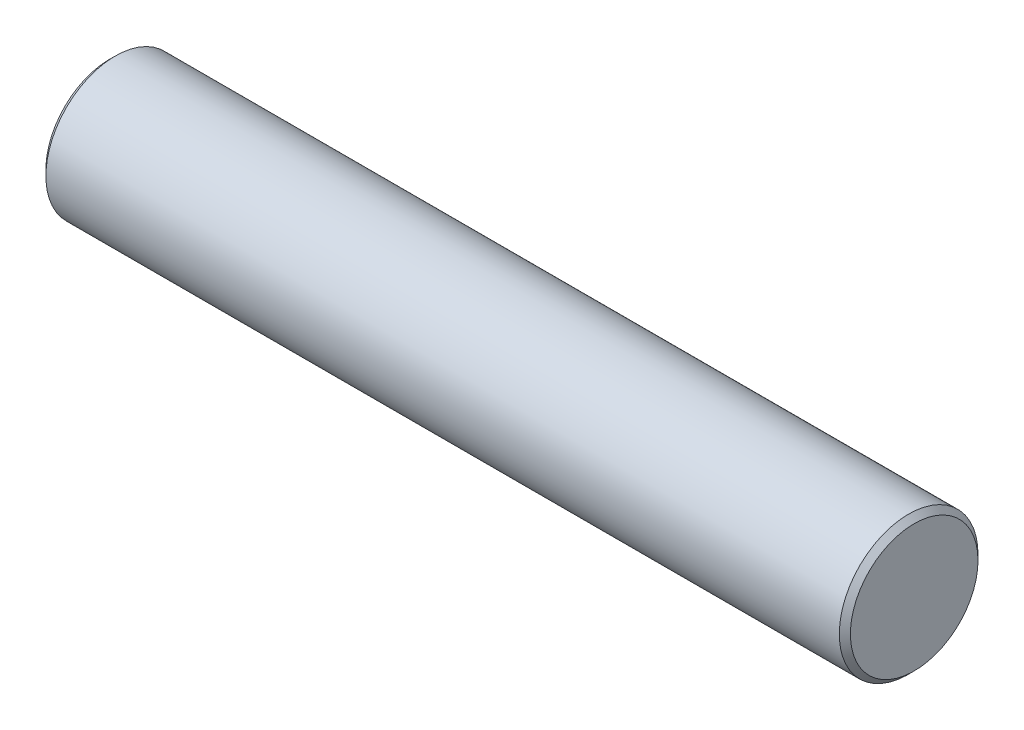
from build123d import *

# Parameters (mm, degrees)
SKETCH1_R           = 12.5
BOSS_EXTRUDE1_DEPTH = 145
CHAMFER1_SIZE       = 1


with BuildPart() as part:
    # Sketch1 → Boss-Extrude1 (new body)
    with BuildSketch(Plane(origin=(0, 0, 0), x_dir=(0, 0, -1), z_dir=(1, 0, 0))):
        Circle(SKETCH1_R)
    extrude(amount=BOSS_EXTRUDE1_DEPTH)

    # Chamfer1
    chamfer1_edges = [part.edges().sort_by_distance(p)[0] for p in [
        (0, 0, 12.5),
        (145, 0, 12.5),
    ]]
    chamfer(chamfer1_edges, length=CHAMFER1_SIZE)


solid = part.part
